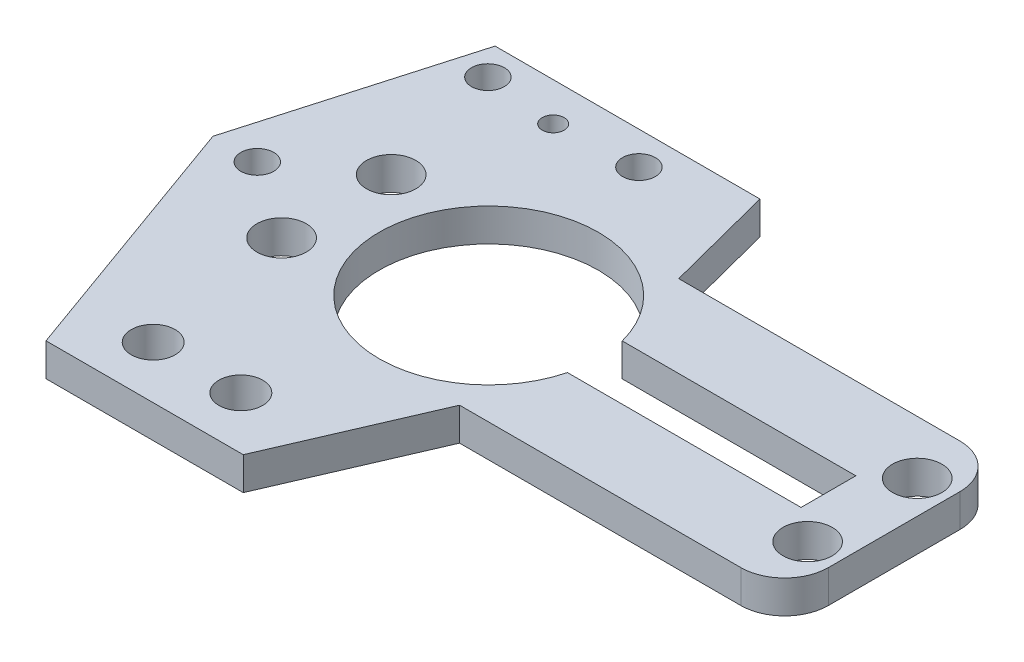
from build123d import *

# Parameters (mm, degrees)
SKETCH_1_R      = 2
SKETCH_1_R_2    = 1
SKETCH_1_R_3    = 1.5
SKETCH_1_R_4    = 2.25
EXTRUDE_1_DEPTH = 3
FILLET_1_R      = 4


with BuildPart() as part:
    # 草图1 → 凸台-拉伸1 (new body)
    with BuildSketch(Plane(origin=(0, 0, 0), x_dir=(1, 0, 0), z_dir=(0, 1, 0))):
        Polygon((-9, -23.780312322), (-17.547496939, 0), (-11.800187967, 20), (12.367390868, 20), (14.956440464, 10), (44.617690385, 10), (44.617690385, -10), (14.956440464, -10), (9, -23.780312322), align=None)
        with Locations(Location((-4, -19, 0), (0, 0, 270))):
            Circle(SKETCH_1_R, mode=Mode.SUBTRACT)
        with Locations(Location((4, -19, 0), (0, 0, 270))):
            Circle(SKETCH_1_R, mode=Mode.SUBTRACT)
        with Locations(Location((-3, 16.5, 0), (0, 0, 270))):
            Circle(SKETCH_1_R_2, mode=Mode.SUBTRACT)
        with Locations(Location((4.324928848, 17, 0), (0, 0, 270))):
            Circle(SKETCH_1_R_3, mode=Mode.SUBTRACT)
        with Locations(Location((41.617690385, 5.1, 0), (0, 0, 270))):
            Circle(SKETCH_1_R_4, mode=Mode.SUBTRACT)
        with Locations(Location((41.617690385, -4.9, 0), (0, 0, 270))):
            Circle(SKETCH_1_R_4, mode=Mode.SUBTRACT)
        with Locations(Location((-6.382309615, -4.9, 0), (0, 0, 270))):
            Circle(SKETCH_1_R_4, mode=Mode.SUBTRACT)
        with Locations(Location((-6.382309615, 5.1, 0), (0, 0, 270))):
            Circle(SKETCH_1_R_4, mode=Mode.SUBTRACT)
        with Locations(Location((-13.5, 0, 0), (0, 0, 270))):
            Circle(SKETCH_1_R_3, mode=Mode.SUBTRACT)
        with Locations(Location((-9.67339824, 17.216422607, 0), (0, 0, 270))):
            Circle(SKETCH_1_R_3, mode=Mode.SUBTRACT)
        with BuildLine():
            Line((17.30014875, -2.5), (38.617690385, -2.5))
            Line((38.617690385, -2.5), (38.617690385, 2.5))
            Line((38.617690385, 2.5), (17.30014875, 2.5))
            ThreePointArc((17.30014875, 2.5), (-2.382309615, 0), (17.30014875, -2.5))
        make_face(mode=Mode.SUBTRACT)
    extrude(amount=EXTRUDE_1_DEPTH)

    # 圆角1
    fillet_1_edges = [part.edges().sort_by_distance(p)[0] for p in [
        (44.617690385, 1.5, -10),
        (44.617690385, 1.5, 10),
    ]]
    fillet(fillet_1_edges, radius=FILLET_1_R)


solid = part.part
